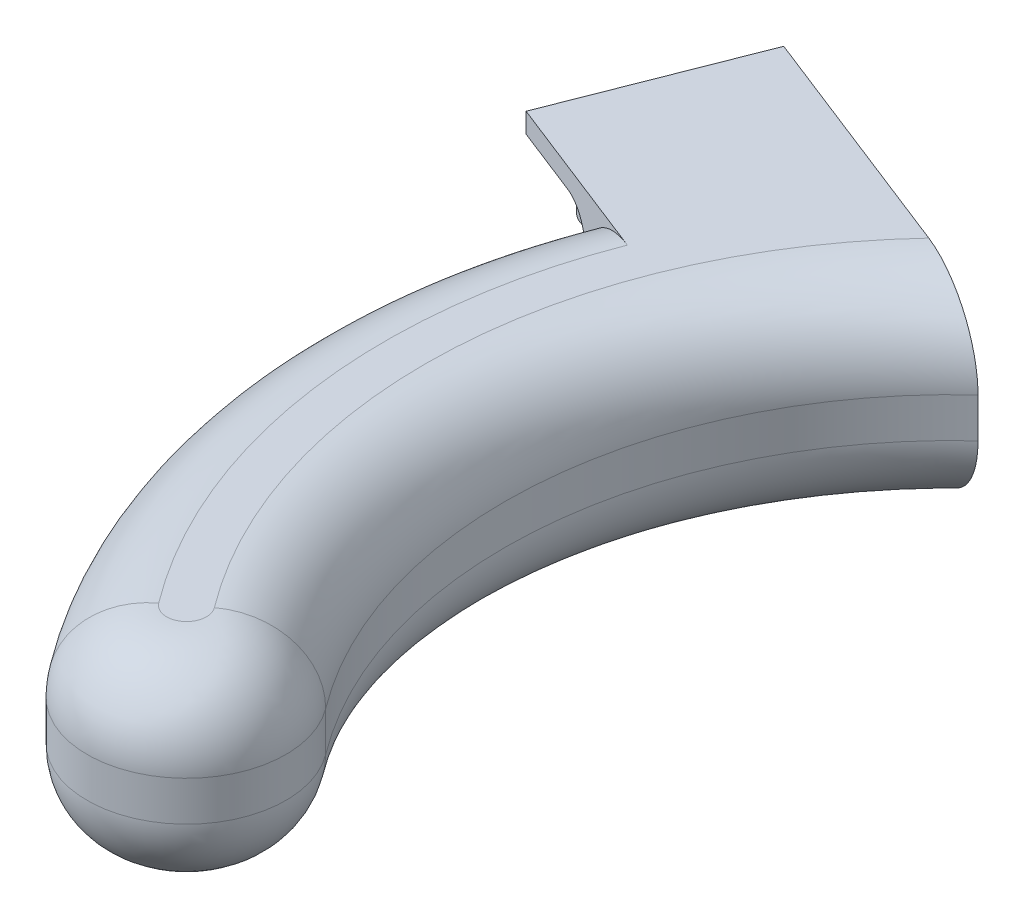
from build123d import *

# Parameters (mm, degrees)
BOSS_EXTRUDE1_DEPTH = 20
FILLET4_R           = 8
SHELL4_T            = -2
BOSS_EXTRUDE3_DEPTH = 2
FILLET5_R           = 3
SKETCH4_R           = 3
BOSS_EXTRUDE4_DEPTH = 5


with BuildPart() as part:
    # Sketch1 → Boss-Extrude1 (new body)
    with BuildSketch(Plane(origin=(0, 0, 0), x_dir=(1, 0, 0), z_dir=(0, 1, 0))):
        with BuildLine():
            Line((-30.483789425, 33.101942273), (-50.483789425, 40.943705319))
            ThreePointArc((-50.483789425, 40.943705319), (-64.988970557, 1.197374595), (-51.957731338, -39.056294681))
            ThreePointArc((-51.957731338, -39.056294681), (-37.955573489, -41.04113109), (-35.97073708, -27.038973241))
            ThreePointArc((-35.97073708, -27.038973241), (-44.813875675, 4.088587411), (-30.483789425, 33.101942273))
        make_face()
    extrude(amount=BOSS_EXTRUDE1_DEPTH)

    # Fillet4
    fillet4_edges = [part.edges().sort_by_distance(p)[0] for p in [
        (-44.813875675, 20, -4.088587411),
        (-64.988970557, 20, -1.197374595),
        (-44.813875675, 0, -4.088587411),
        (-37.955573489, 0, 41.04113109),
        (-64.988970557, 0, -1.197374595),
        (-37.955573489, 20, 41.04113109),
    ]]
    fillet(fillet4_edges, radius=FILLET4_R)

    # Shell4
    shell4_openings = [part.faces().sort_by_distance(p)[0] for p in [
        (-40.508625428, 10, -37.032561699),
    ]]
    offset(amount=SHELL4_T, openings=shell4_openings, kind=Kind.INTERSECTION)

    # Sketch2 → Boss-Extrude3 (add)
    with BuildSketch(Plane(origin=(0, 20, 0), x_dir=(1, 0, 0), z_dir=(0, 1, 0))):
        Polygon((-39.36151224, 36.582792208), (-62.636385717, 45.708594344), (-69.937027426, 27.088695563), (-51.317128644, 19.788053854), align=None)
    extrude(amount=-BOSS_EXTRUDE3_DEPTH)

    # Fillet5
    fillet5_edges = [part.edges().sort_by_distance(p)[0] for p in [
        (-53.682873098, 18, -31.597158652),
    ]]
    fillet(fillet5_edges, radius=FILLET5_R)

    # Sketch4 → Boss-Extrude4 (add)
    with BuildSketch(Plane.XZ.offset(-18)):
        with Locations(Location((-59.806571448, -39.228459222, 0), (0, 0, 90))):
            Circle(SKETCH4_R)
        with Locations(Location((-63.456892303, -29.918509831, 0), (0, 0, 55.543794566))):
            Circle(SKETCH4_R)
    extrude(amount=BOSS_EXTRUDE4_DEPTH)


solid = part.part
